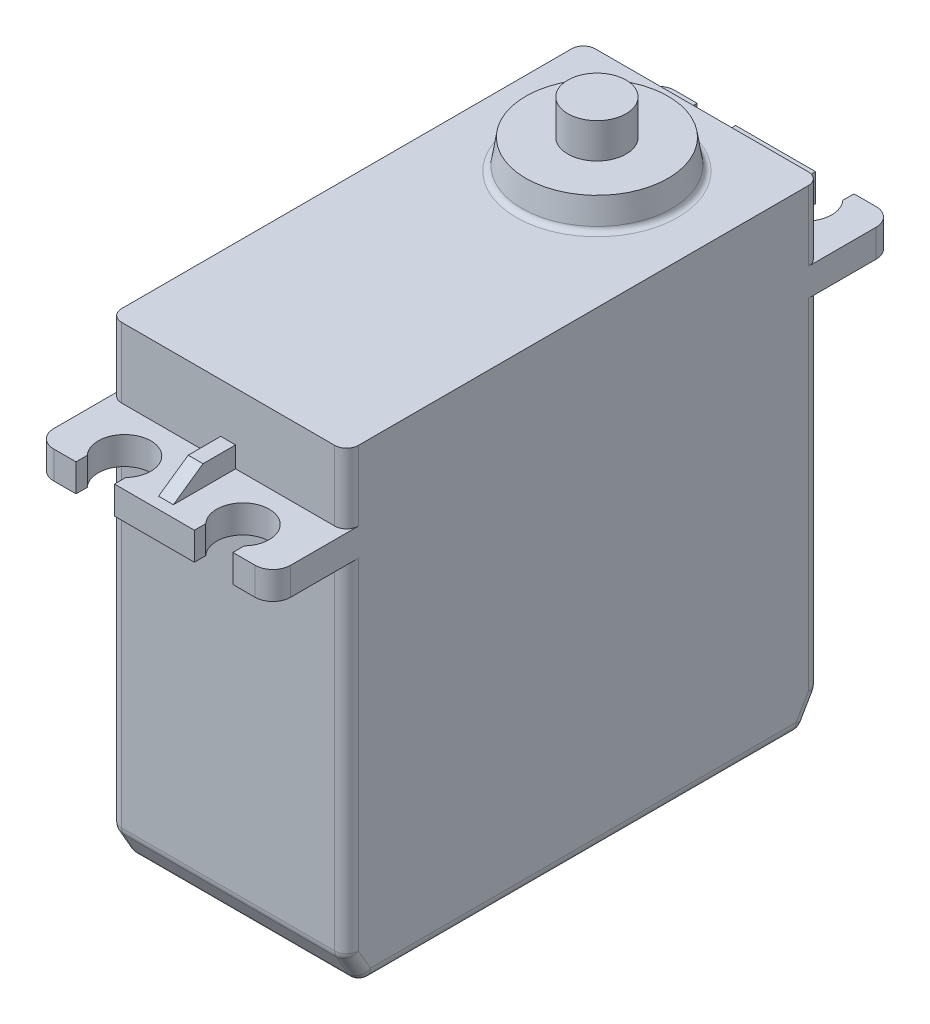
from build123d import *
from OCP.BRepFilletAPI import BRepFilletAPI_MakeChamfer

# Parameters (mm, degrees)
SKETCH1_W          = 20.32
SKETCH1_H          = 40.64
EXTRUDE1_DEPTH     = 32
SKETCH2_W          = 20.32
SKETCH2_H          = 40.64
EXTRUDE2_DEPTH     = 2.38125
SKETCH3_W          = 20.32
SKETCH3_H          = 40.64
EXTRUDE3_DEPTH     = 6
EXTRUDE6_DEPTH     = 0.635
CHAMFER2_SIZE      = 2.54
CHAMFER2_SIZE2     = 1.466469684
FILLET1_R          = 1.016
FILLET2_R          = 1.524
SKETCH9_W          = 6.35
SKETCH9_H          = 2.54
EXTRUDE8_DEPTH     = 2.38125
SKETCH10_W         = 5.08
SKETCH10_H         = 1.27
CUT_EXTRUDE1_DEPTH = 2.38125
SKETCH_1_R         = 6.5
EXTRUDE_1_DEPTH    = 2.5
EXTRUDE_1_TAPER    = 9
FILLET_1_R         = 0.5
SKETCH_2_R         = 2.5
EXTRUDE_2_DEPTH    = 3


with BuildPart() as part:
    # Sketch1 → Extrude1 (new body)
    with BuildSketch(Plane(origin=(0, 0, 0), x_dir=(1, 0, 0), z_dir=(0, 1, 0))):
        with Locations((0, -10.16)):
            Rectangle(SKETCH1_W, SKETCH1_H)
    extrude(amount=EXTRUDE1_DEPTH)

    # Sketch2 → Extrude2 (add)
    with BuildSketch(Plane(origin=(0, 32, 0), x_dir=(-1, 0, 0), z_dir=(0, 1, 0))):
        with Locations((0, 10.16)):
            Rectangle(SKETCH2_W, SKETCH2_H)
        with BuildLine():
            ThreePointArc((6.731, -15.51418631), (5.08, -11.7094), (3.429, -15.51418631))
            Line((3.429, -15.51418631), (3.429, -16.4846))
            Line((3.429, -16.4846), (-3.429, -16.4846))
            Line((-3.429, -16.4846), (-3.429, -15.51418631))
            ThreePointArc((-3.429, -15.51418631), (-5.08, -11.7094), (-6.731, -15.51418631))
            Line((-6.731, -15.51418631), (-6.731, -16.4846))
            Line((-6.731, -16.4846), (-10.16, -16.4846))
            Line((-10.16, -16.4846), (-10.16, -10.16))
            Line((-10.16, -10.16), (10.16, -10.16))
            Line((10.16, -10.16), (10.16, -16.4846))
            Line((10.16, -16.4846), (6.731, -16.4846))
            Line((6.731, -16.4846), (6.731, -15.51418631))
        make_face()
        with BuildLine():
            ThreePointArc((-6.731, 35.83418631), (-5.08, 32.0294), (-3.429, 35.83418631))
            Line((-3.429, 35.83418631), (-3.429, 36.8046))
            Line((-3.429, 36.8046), (3.429, 36.8046))
            Line((3.429, 36.8046), (3.429, 35.83418631))
            ThreePointArc((3.429, 35.83418631), (5.08, 32.0294), (6.731, 35.83418631))
            Line((6.731, 35.83418631), (6.731, 36.8046))
            Line((6.731, 36.8046), (10.16, 36.8046))
            Line((10.16, 36.8046), (10.16, 30.48))
            Line((10.16, 30.48), (-10.16, 30.48))
            Line((-10.16, 30.48), (-10.16, 36.8046))
            Line((-10.16, 36.8046), (-6.731, 36.8046))
            Line((-6.731, 36.8046), (-6.731, 35.83418631))
        make_face()
    extrude(amount=EXTRUDE2_DEPTH)

    # Sketch3 → Extrude3 (add)
    with BuildSketch(Plane(origin=(0, 34.38125, 0), x_dir=(-1, 0, 0), z_dir=(0, 1, 0))):
        with Locations((0, 10.16)):
            Rectangle(SKETCH3_W, SKETCH3_H)
    extrude(amount=EXTRUDE3_DEPTH)

    # Sketch7 → Extrude6 (add, symmetric)
    with BuildSketch(Plane(origin=(0, 0, 0), x_dir=(0, 0, -1), z_dir=(1, 0, 0))):
        Polygon((15.494, 34.38125), (12.954, 36.15925), (10.16, 36.15925), (10.16, 34.38125), align=None)
    extrude6 = extrude(amount=EXTRUDE6_DEPTH, both=True)

    # Mirror1: Extrude6 across plane
    add(extrude6.mirror(Plane(origin=(0, 0, 10.16), x_dir=(1, 0, 0), z_dir=(0, 0, -1))))

    # Chamfer2: one chamfer whose edges measure the first distance from different faces: ONE call of the kernel's chamfer builder (chamfer() names one face for all edges)
    chamfer2_edges_1 = [part.edges().sort_by_distance(p)[0] for p in [
        (0, 0, -10.16),
    ]]
    chamfer2_side_1 = [part.faces().sort_by_distance(p)[0] for p in [
        (0, 16, -10.16),
    ]]
    chamfer2_edges_2 = [part.edges().sort_by_distance(p)[0] for p in [
        (0, 0, 30.48),
    ]]
    chamfer2_side_2 = [part.faces().sort_by_distance(p)[0] for p in [
        (0, 16, 30.48),
    ]]
    chamfer2 = BRepFilletAPI_MakeChamfer(part.part.solid().wrapped)
    for e in chamfer2_edges_1:
        chamfer2.Add(CHAMFER2_SIZE, CHAMFER2_SIZE2, e.wrapped, chamfer2_side_1[0].wrapped)  # the first distance lies on this face
    for e in chamfer2_edges_2:
        chamfer2.Add(CHAMFER2_SIZE, CHAMFER2_SIZE2, e.wrapped, chamfer2_side_2[0].wrapped)  # the first distance lies on this face
    add(Compound.cast(chamfer2.Shape()), mode=Mode.REPLACE)

    # Fillet1
    fillet1_edges = [part.edges().sort_by_distance(p)[0] for p in [
        (-10.16, 37.38125, -10.16),
        (10.16, 37.38125, -10.16),
        (10.16, 37.38125, 30.48),
        (10.16, 0, 10.16),
        (10.16, 1.27, -9.426765158),
        (10.16, 17.27, -10.16),
        (0, 0, -8.693530316),
        (0, 2.54, -10.16),
        (-10.16, 17.27, -10.16),
        (-10.16, 1.27, -9.426765158),
        (10.16, 17.27, 30.48),
        (10.16, 1.27, 29.746765158),
        (0, 2.54, 30.48),
        (-10.16, 0, 10.16),
        (0, 0, 29.013530316),
        (-10.16, 1.27, 29.746765158),
        (-10.16, 17.27, 30.48),
        (-10.16, 37.38125, 30.48),
    ]]
    fillet(fillet1_edges, radius=FILLET1_R)

    # Fillet2
    fillet2_edges = [part.edges().sort_by_distance(p)[0] for p in [
        (-10.16, 33.190625, 36.8046),
        (10.16, 33.190625, 36.8046),
        (-10.16, 33.190625, -16.4846),
        (10.16, 33.190625, -16.4846),
    ]]
    fillet(fillet2_edges, radius=FILLET2_R)

    # Sketch9 → Extrude8 (add)
    with BuildSketch(Plane(origin=(0, 0, -10.16), x_dir=(-1, 0, 0), z_dir=(0, 0, -1))):
        with Locations((0, 11.27)):
            Rectangle(SKETCH9_W, SKETCH9_H)
    extrude(amount=EXTRUDE8_DEPTH)

    # Sketch10 → Cut-Extrude1 (cut)
    with BuildSketch(Plane(origin=(0, 0, -12.54125), x_dir=(-1, 0, 0), z_dir=(0, 0, -1))):
        with Locations((0, 11.27)):
            Rectangle(SKETCH10_W, SKETCH10_H)
    extrude(amount=-CUT_EXTRUDE1_DEPTH, mode=Mode.SUBTRACT)

    # Эскиз1 → Вытянуть1 (add)
    with BuildSketch(Plane(origin=(0, 40.38125, 0), x_dir=(1, 0, 0), z_dir=(0, 1, 0))):
        with Locations((0, 1.16)):
            Circle(SKETCH_1_R)
    extrude(amount=EXTRUDE_1_DEPTH, taper=EXTRUDE_1_TAPER)

    # Скругление1
    fillet_1_edges = [part.edges().sort_by_distance(p)[0] for p in [
        (-6.5, 40.38125, -1.16),
    ]]
    fillet(fillet_1_edges, radius=FILLET_1_R)

    # Эскиз2 → Вытянуть2 (add)
    with BuildSketch(Plane(origin=(0, 42.88125, 0), x_dir=(1, 0, 0), z_dir=(0, 1, 0))):
        with Locations(Location((0, 1.16, 0), (0, 0, 270))):
            Circle(SKETCH_2_R)
    extrude(amount=EXTRUDE_2_DEPTH)


solid = part.part
